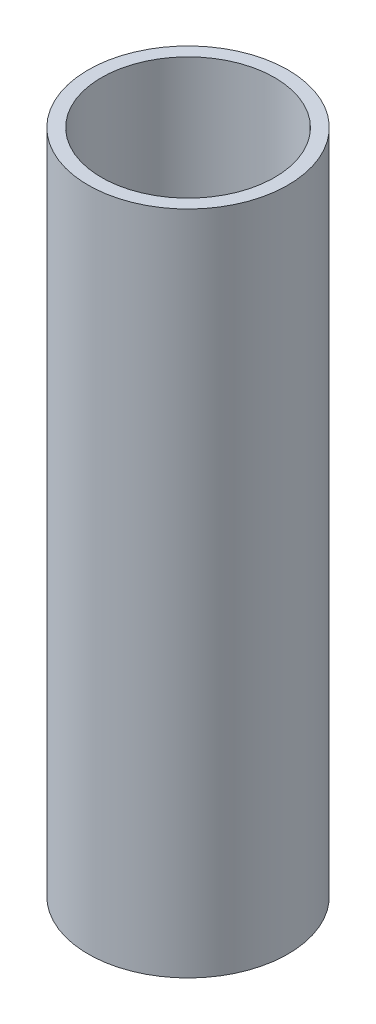
from build123d import *

# Parameters (mm, degrees)
SKETCH_1_R          = 15
SKETCH_1_R_2        = 13
EXTRUDE_1_DEPTH     = 90
EXTRUDE_START       = 10
SKETCH_2_R          = 15
EXTRUDE_2_DEPTH     = 10
CUT_EXTRUDE_1_DEPTH = 4
SKETCH_4_R          = 3.25
CUT_EXTRUDE_2_DEPTH = 97.363893653


with BuildPart() as part:
    # Эскиз1 → Бобышка-Вытянуть1 (new body)
    with BuildSketch(Plane(origin=(0, 0, 0), x_dir=(1, 0, 0), z_dir=(0, 1, 0))):
        with Locations(Location((0, 0, 0), (0, 0, 90))):
            Circle(SKETCH_1_R)
        with Locations(Location((0, 0, 0), (0, 0, 90))):
            Circle(SKETCH_1_R_2, mode=Mode.SUBTRACT)
    extrude(amount=EXTRUDE_1_DEPTH)

    # Эскиз2 → Бобышка-Вытянуть2 (add)
    with BuildSketch(Plane.XZ.offset(EXTRUDE_START)):
        with Locations(Location((0, 0, 0), (0, 0, 270))):
            Circle(SKETCH_2_R)
    extrude(amount=-EXTRUDE_2_DEPTH)

    # Эскиз3 → Вырез-Вытянуть1 (cut)
    with BuildSketch(Plane(origin=(0, 0, 0), x_dir=(1, 0, 0), z_dir=(0, 1, 0))):
        Polygon((2.886751346, 5), (-2.886751346, 5), (-5.773502692, 0), (-2.886751346, -5), (2.886751346, -5), (5.773502692, 0), align=None)
    extrude(amount=-CUT_EXTRUDE_1_DEPTH, mode=Mode.SUBTRACT)

    # Эскиз4 → Вырез-Вытянуть2 (cut, through all)
    with BuildSketch(Plane(origin=(0, -4, 0), x_dir=(1, 0, 0), z_dir=(0, 1, 0))):
        with Locations(Location((0, 0, 0), (0, 0, 270))):
            Circle(SKETCH_4_R)
    extrude(amount=-CUT_EXTRUDE_2_DEPTH, mode=Mode.SUBTRACT)


solid = part.part
